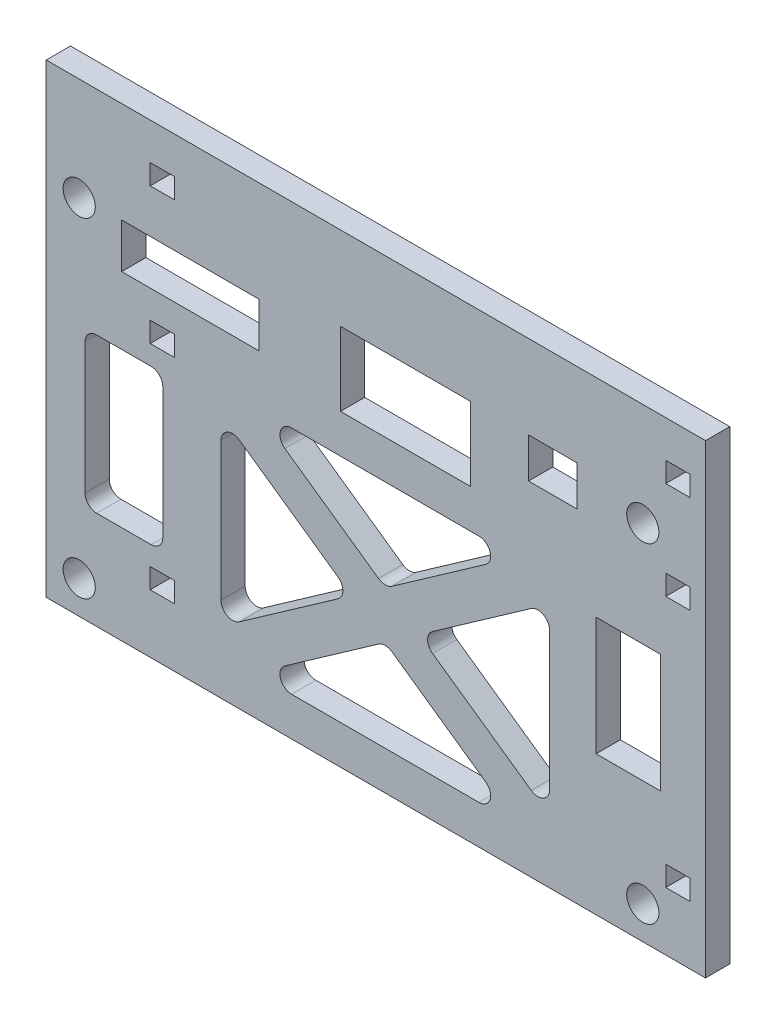
from build123d import *

# Parameters (mm, degrees)
SKETCH1_W                   = 43.18
SKETCH1_H                   = 30.48
SKETCH1_R                   = 1.0541
BOSS_EXTRUDE1_DEPTH         = 1.5875
CAMERA_CUTS_REACH           = 39.386
SKETCH5_W                   = 9
SKETCH5_H                   = 2.93
SKETCH5_W_2                 = 8.509
SKETCH5_H_2                 = 4.826
SKETCH5_W_3                 = 3.175
SKETCH5_H_3                 = 2.6162
SKETCH5_W_4                 = 4.22
SKETCH5_H_4                 = 7.75
SKETCH6_W                   = 5.0927
SKETCH6_H                   = 10.1092
WEIGHT_REDUCTION_CUTS_DEPTH = 2.54
ATTACHMENT_CUTS_REACH       = 39.386
SKETCH7_W                   = 1.5875
SKETCH7_H                   = 1.3208
FILLET8_R                   = 0.762


with BuildPart() as part:
    # Sketch1 → Boss-Extrude1 (new body)
    with BuildSketch(Plane.XY):
        with Locations((0, 15.24)):
            Rectangle(SKETCH1_W, SKETCH1_H)
        with Locations((17.48282, 2.159)):
            Circle(SKETCH1_R, mode=Mode.SUBTRACT)
        with Locations((17.48282, 23.749)):
            Circle(SKETCH1_R, mode=Mode.SUBTRACT)
        with Locations((-19.431, 2.159)):
            Circle(SKETCH1_R, mode=Mode.SUBTRACT)
        with Locations((-19.431, 23.749)):
            Circle(SKETCH1_R, mode=Mode.SUBTRACT)
    extrude(amount=BOSS_EXTRUDE1_DEPTH)

    # Sketch5 → Camera Cuts (cut, up to next)
    with BuildSketch(Plane.XY.offset(1.5875), mode=Mode.PRIVATE) as camera_cuts_sk1:
        with Locations((-12.151, 22.413)):
            Rectangle(SKETCH5_W, SKETCH5_H)
    camera_cuts_tool1 = extrude(camera_cuts_sk1.sketch, amount=-CAMERA_CUTS_REACH, mode=Mode.PRIVATE) & part.part
    # Sketch5 → Camera Cuts (cut, up to next)
    with BuildSketch(Plane.XY.offset(1.5875), mode=Mode.PRIVATE) as camera_cuts_sk2:
        with Locations((1.9341, 22.597)):
            Rectangle(SKETCH5_W_2, SKETCH5_H_2)
    camera_cuts_tool2 = extrude(camera_cuts_sk2.sketch, amount=-CAMERA_CUTS_REACH, mode=Mode.PRIVATE) & part.part
    # Sketch5 → Camera Cuts (cut, up to next)
    with BuildSketch(Plane.XY.offset(1.5875), mode=Mode.PRIVATE) as camera_cuts_sk3:
        with Locations((11.5861, 23.7019)):
            Rectangle(SKETCH5_W_3, SKETCH5_H_3)
    camera_cuts_tool3 = extrude(camera_cuts_sk3.sketch, amount=-CAMERA_CUTS_REACH, mode=Mode.PRIVATE) & part.part
    # Sketch5 → Camera Cuts (cut, up to next)
    with BuildSketch(Plane.XY.offset(1.5875), mode=Mode.PRIVATE) as camera_cuts_sk4:
        with Locations((16.5326, 13.0085)):
            Rectangle(SKETCH5_W_4, SKETCH5_H_4)
    camera_cuts_tool4 = extrude(camera_cuts_sk4.sketch, amount=-CAMERA_CUTS_REACH, mode=Mode.PRIVATE) & part.part
    add(camera_cuts_tool1.solids().sort_by_distance((-12.151, 22.413, 1.5875))[0], mode=Mode.SUBTRACT)
    add(camera_cuts_tool2.solids().sort_by_distance((1.9341, 22.597, 1.5875))[0], mode=Mode.SUBTRACT)
    add(camera_cuts_tool3.solids().sort_by_distance((11.5861, 23.7019, 1.5875))[0], mode=Mode.SUBTRACT)
    add(camera_cuts_tool4.solids().sort_by_distance((16.5326, 13.0085, 1.5875))[0], mode=Mode.SUBTRACT)

    # Sketch6 → Weight Reduction Cuts (cut)
    with BuildSketch(Plane.XY.offset(1.5875)):
        Polygon((9.163785799, 2.54), (0.61365, 8.540457725), (-7.936485799, 2.54), align=None)
        Polygon((2.824464201, 10.092), (11.3746, 4.091542275), (11.3746, 16.092457725), align=None)
        Polygon((-7.936485799, 17.644), (0.61365, 11.643542275), (9.163785799, 17.644), align=None)
        Polygon((-10.1473, 4.091542275), (-1.597164201, 10.092), (-10.1473, 16.092457725), align=None)
        with Locations((-16.50365, 11.479427373)):
            Rectangle(SKETCH6_W, SKETCH6_H)
    extrude(amount=-WEIGHT_REDUCTION_CUTS_DEPTH, mode=Mode.SUBTRACT)

    # Sketch7 → Attachment Cuts (cut, up to next)
    with BuildSketch(Plane(origin=(0, 0, 0), x_dir=(-1, 0, 0), z_dir=(0, 0, -1)), mode=Mode.PRIVATE) as attachment_cuts_sk1:
        with Locations((13.98905, 27.405227373)):
            Rectangle(SKETCH7_W, SKETCH7_H)
    attachment_cuts_tool1 = extrude(attachment_cuts_sk1.sketch, amount=-ATTACHMENT_CUTS_REACH, mode=Mode.PRIVATE) & part.part
    # Sketch7 → Attachment Cuts (cut, up to next)
    with BuildSketch(Plane(origin=(0, 0, 0), x_dir=(-1, 0, 0), z_dir=(0, 0, -1)), mode=Mode.PRIVATE) as attachment_cuts_sk2:
        with Locations((13.98905, 18.464427373)):
            Rectangle(SKETCH7_W, SKETCH7_H)
    attachment_cuts_tool2 = extrude(attachment_cuts_sk2.sketch, amount=-ATTACHMENT_CUTS_REACH, mode=Mode.PRIVATE) & part.part
    # Sketch7 → Attachment Cuts (cut, up to next)
    with BuildSketch(Plane(origin=(0, 0, 0), x_dir=(-1, 0, 0), z_dir=(0, 0, -1)), mode=Mode.PRIVATE) as attachment_cuts_sk3:
        with Locations((13.98905, 4.494427373)):
            Rectangle(SKETCH7_W, SKETCH7_H)
    attachment_cuts_tool3 = extrude(attachment_cuts_sk3.sketch, amount=-ATTACHMENT_CUTS_REACH, mode=Mode.PRIVATE) & part.part
    # Sketch7 → Attachment Cuts (cut, up to next)
    with BuildSketch(Plane(origin=(0, 0, 0), x_dir=(-1, 0, 0), z_dir=(0, 0, -1)), mode=Mode.PRIVATE) as attachment_cuts_sk4:
        with Locations((-19.78025, 4.494427373)):
            Rectangle(SKETCH7_W, SKETCH7_H)
    attachment_cuts_tool4 = extrude(attachment_cuts_sk4.sketch, amount=-ATTACHMENT_CUTS_REACH, mode=Mode.PRIVATE) & part.part
    # Sketch7 → Attachment Cuts (cut, up to next)
    with BuildSketch(Plane(origin=(0, 0, 0), x_dir=(-1, 0, 0), z_dir=(0, 0, -1)), mode=Mode.PRIVATE) as attachment_cuts_sk5:
        with Locations((-19.78025, 21.004427373)):
            Rectangle(SKETCH7_W, SKETCH7_H)
    attachment_cuts_tool5 = extrude(attachment_cuts_sk5.sketch, amount=-ATTACHMENT_CUTS_REACH, mode=Mode.PRIVATE) & part.part
    # Sketch7 → Attachment Cuts (cut, up to next)
    with BuildSketch(Plane(origin=(0, 0, 0), x_dir=(-1, 0, 0), z_dir=(0, 0, -1)), mode=Mode.PRIVATE) as attachment_cuts_sk6:
        with Locations((-19.78025, 27.405227373)):
            Rectangle(SKETCH7_W, SKETCH7_H)
    attachment_cuts_tool6 = extrude(attachment_cuts_sk6.sketch, amount=-ATTACHMENT_CUTS_REACH, mode=Mode.PRIVATE) & part.part
    add(attachment_cuts_tool1.solids().sort_by_distance((-13.98905, 27.405227, 0))[0], mode=Mode.SUBTRACT)
    add(attachment_cuts_tool2.solids().sort_by_distance((-13.98905, 18.464427, 0))[0], mode=Mode.SUBTRACT)
    add(attachment_cuts_tool3.solids().sort_by_distance((-13.98905, 4.494427, 0))[0], mode=Mode.SUBTRACT)
    add(attachment_cuts_tool4.solids().sort_by_distance((19.78025, 4.494427, 0))[0], mode=Mode.SUBTRACT)
    add(attachment_cuts_tool5.solids().sort_by_distance((19.78025, 21.004427, 0))[0], mode=Mode.SUBTRACT)
    add(attachment_cuts_tool6.solids().sort_by_distance((19.78025, 27.405227, 0))[0], mode=Mode.SUBTRACT)

    # Fillet8
    fillet8_edges = [part.edges().sort_by_distance(p)[0] for p in [
        (9.163785799, 17.644, 0.79375),
        (0.61365, 11.643542275, 0.79375),
        (-7.936485799, 17.644, 0.79375),
        (-1.597164201, 10.092, 0.79375),
        (-10.1473, 4.091542275, 0.79375),
        (-10.1473, 16.092457725, 0.79375),
        (-13.9573, 6.424827373, 0.79375),
        (-19.05, 6.424827373, 0.79375),
        (-19.05, 16.534027373, 0.79375),
        (-13.9573, 16.534027373, 0.79375),
        (0.61365, 8.540457725, 0.79375),
        (9.163785799, 2.54, 0.79375),
        (-7.936485799, 2.54, 0.79375),
        (11.3746, 16.092457725, 0.79375),
        (11.3746, 4.091542275, 0.79375),
        (2.824464201, 10.092, 0.79375),
    ]]
    fillet(fillet8_edges, radius=FILLET8_R)


solid = part.part
